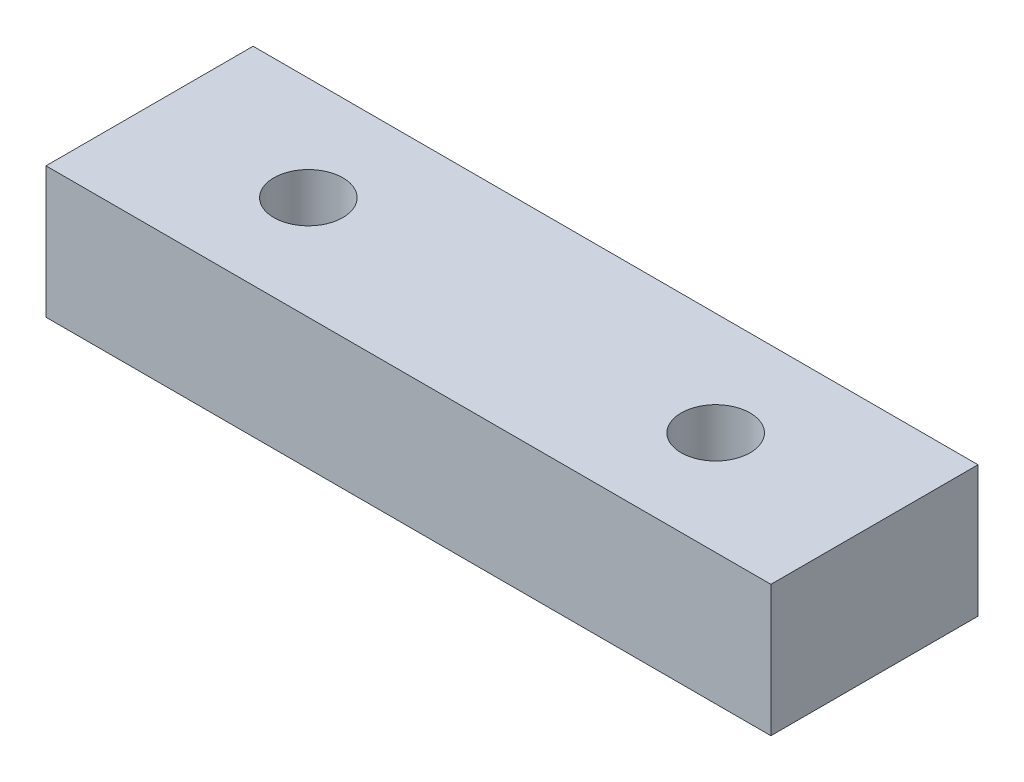
from build123d import *

# Parameters (mm, degrees)
SKETCH1_W           = 21
SKETCH1_H           = 6
SKETCH1_R           = 1
BOSS_EXTRUDE1_DEPTH = 3.8


with BuildPart() as part:
    # Sketch1 → Boss-Extrude1 (new body)
    with BuildSketch(Plane(origin=(0, 0, 0), x_dir=(1, 0, 0), z_dir=(0, 1, 0))):
        with Locations((-62.510204931, 6.6)):
            Rectangle(SKETCH1_W, SKETCH1_H)
        with Locations(Location((-56.610204931, 6.6, 0), (0, 0, 90))):
            Circle(SKETCH1_R, mode=Mode.SUBTRACT)
        with Locations(Location((-68.410204931, 6.6, 0), (0, 0, 90))):
            Circle(SKETCH1_R, mode=Mode.SUBTRACT)
    extrude(amount=BOSS_EXTRUDE1_DEPTH)


solid = part.part
